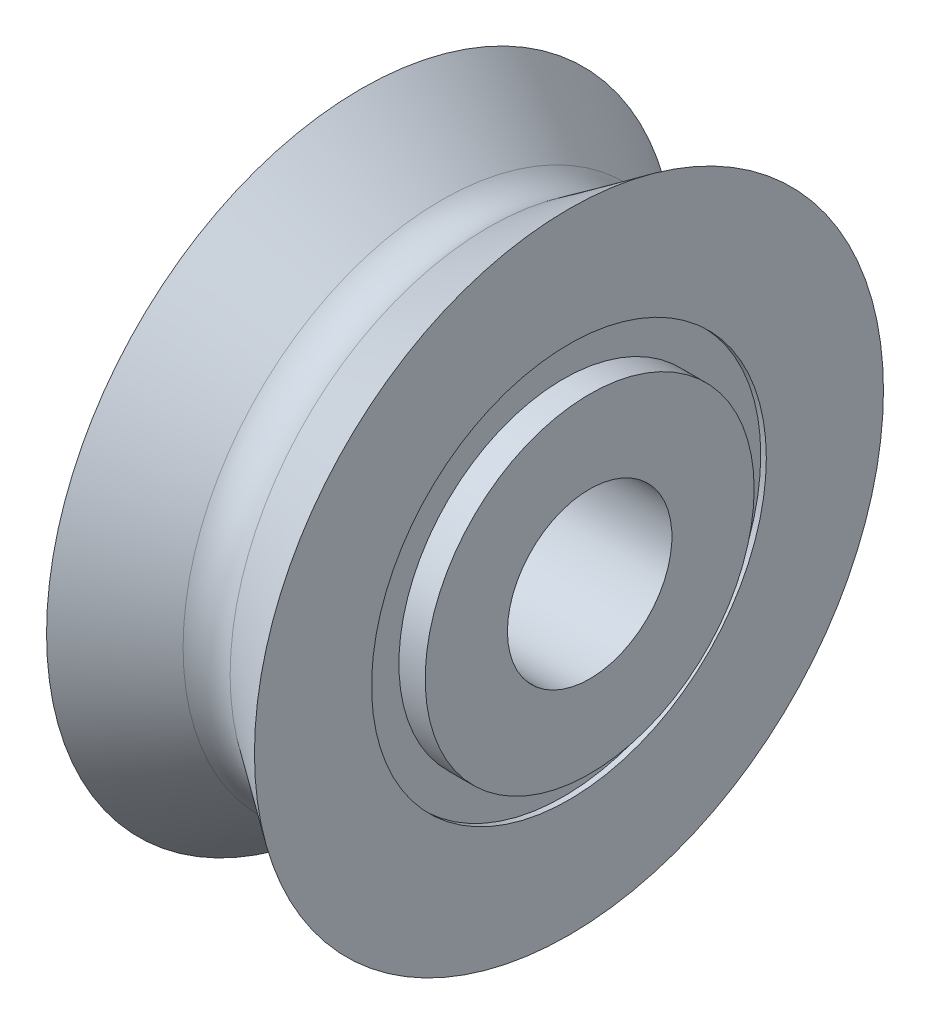
from build123d import *

# Parameters (mm, degrees)
SKETCH4_R          = 3.81
SKETCH4_R_2        = 3.175
CUT_EXTRUDE1_DEPTH = 0.508
CUT_EXTRUDE2_START = -0.508
SKETCH5_R          = 3.81
SKETCH5_R_2        = 3.175
CUT_EXTRUDE2_DEPTH = 0.508
SKETCH7_R          = 6.35
SKETCH7_R_2        = 3.81
CUT_EXTRUDE3_DEPTH = 0.40005
CUT_EXTRUDE4_START = -0.40005
SKETCH8_R          = 6.35
SKETCH8_R_2        = 3.81
CUT_EXTRUDE4_DEPTH = 0.40005


with BuildPart() as part:
    # Sketch1 → Revolve1 (revolve)
    with BuildSketch(Plane.XY, mode=Mode.PRIVATE) as revolve1_sk:
        with BuildLine():
            Line((0, 1.5875), (4.8133, 1.5875))
            Line((4.8133, 1.5875), (4.8133, 6.35))
            Line((4.8133, 6.35), (2.860814617, 4.987821073))
            ThreePointArc((2.860814617, 4.987821073), (2.40665, 4.84505), (1.952485383, 4.987821073))
            Line((1.952485383, 4.987821073), (0, 6.35))
            Line((0, 6.35), (0, 1.5875))
        make_face()
    revolve(revolve1_sk.sketch.rotate(Axis((0, 0, 0), (1, 0, 0)), 90), axis=Axis((0, 0, 0), (1, 0, 0)))

    # Sketch4 → Cut-Extrude1 (cut)
    with BuildSketch(Plane(origin=(4.8133, 0, 0), x_dir=(0, 0, -1), z_dir=(1, 0, 0))):
        Circle(SKETCH4_R)
        Circle(SKETCH4_R_2, mode=Mode.SUBTRACT)
    extrude(amount=-CUT_EXTRUDE1_DEPTH, mode=Mode.SUBTRACT)

    # Sketch5 → Cut-Extrude2 (cut)
    with BuildSketch(Plane.ZY.offset(CUT_EXTRUDE2_START)):
        with Locations(Location((0, 0, 0), (0, 0, 180))):
            Circle(SKETCH5_R)
        with Locations(Location((0, 0, 0), (0, 0, 180))):
            Circle(SKETCH5_R_2, mode=Mode.SUBTRACT)
    extrude(amount=CUT_EXTRUDE2_DEPTH, mode=Mode.SUBTRACT)

    # Sketch7 → Cut-Extrude3 (cut)
    with BuildSketch(Plane(origin=(4.8133, 0, 0), x_dir=(0, 0, -1), z_dir=(1, 0, 0))):
        Circle(SKETCH7_R)
        Circle(SKETCH7_R_2, mode=Mode.SUBTRACT)
    extrude(amount=-CUT_EXTRUDE3_DEPTH, mode=Mode.SUBTRACT)

    # Sketch8 → Cut-Extrude4 (cut)
    with BuildSketch(Plane.ZY.offset(CUT_EXTRUDE4_START)):
        Circle(SKETCH8_R)
        Circle(SKETCH8_R_2, mode=Mode.SUBTRACT)
    extrude(amount=CUT_EXTRUDE4_DEPTH, mode=Mode.SUBTRACT)


solid = part.part
